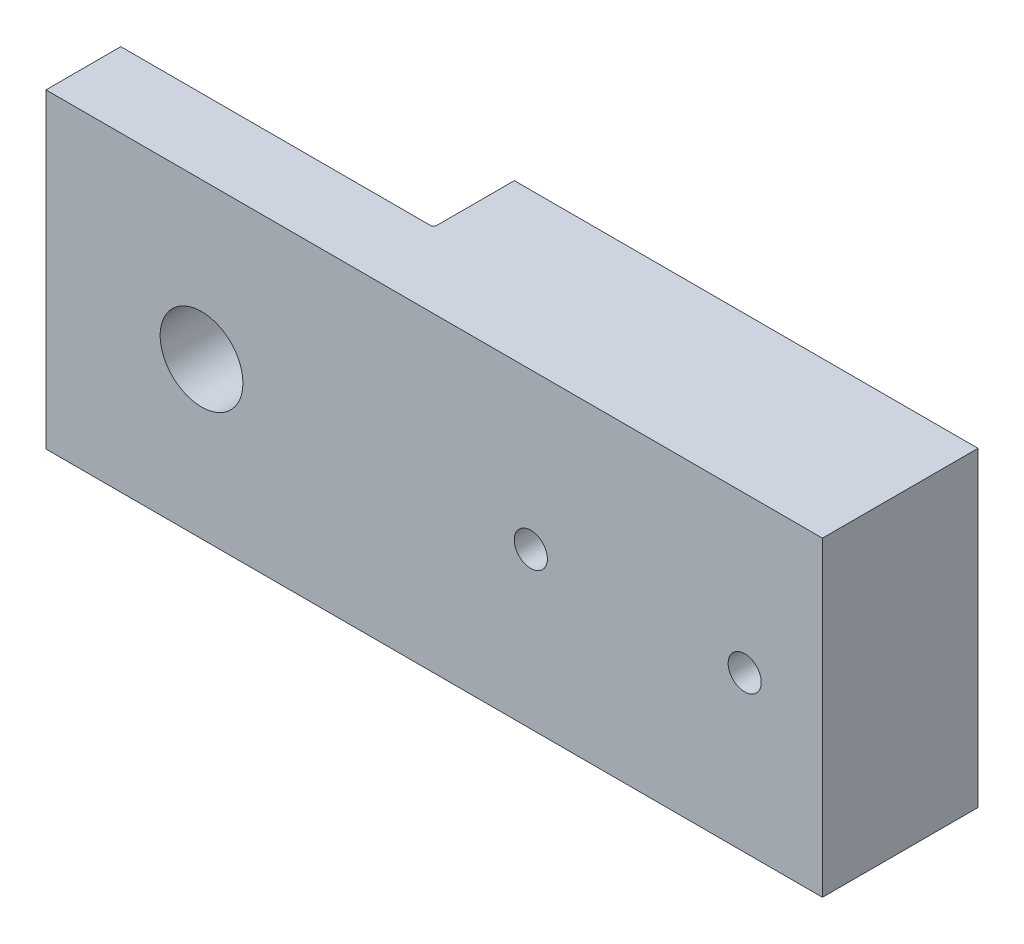
from build123d import *

# Parameters (mm, degrees)
SKETCH1_W                 = 63.398443118
SKETCH1_H                 = 25.4
BOSS_EXTRUDE1_DEPTH       = 6.35
SKETCH2_W                 = 38.1
SKETCH2_H                 = 25.4
BOSS_EXTRUDE2_DEPTH       = 6.35
CUT_EXTRUDE3_DEPTH        = 60.875617776
TAP_DRILL_FOR_6_32_TAP1_D = 2.7051
F_1_4_CLEARANCE_HOLE1_D   = 6.7564


with BuildPart() as part:
    # Sketch1 → Boss-Extrude1 (new body)
    with BuildSketch(Plane.XY):
        with Locations((22.148778441, 406.4)):
            Rectangle(SKETCH1_W, SKETCH1_H)
    extrude(amount=BOSS_EXTRUDE1_DEPTH)

    # Sketch2 → Boss-Extrude2 (add)
    with BuildSketch(Plane(origin=(0, 0, 0), x_dir=(-1, 0, 0), z_dir=(0, 0, -1))):
        with Locations((-34.798, 406.4)):
            Rectangle(SKETCH2_W, SKETCH2_H)
    extrude(amount=BOSS_EXTRUDE2_DEPTH)

    # Sketch7 → Cut-Extrude3 (cut, through all)
    with BuildSketch(Plane(origin=(0, 419.1, 0), x_dir=(1, 0, 0), z_dir=(0, 1, 0))):
        with BuildLine():
            Line((-9.550443118, -0.242852773), (15.748, -0.242852773))
            ThreePointArc((15.748, -0.242852773), (15.919722843, -0.171722843), (15.990852773, 0))
            Line((15.990852773, 0), (15.990852773, 6.35))
            Line((15.990852773, 6.35), (15.748, 6.35))
            Line((15.748, 6.35), (15.748, 0))
            Line((15.748, 0), (-9.550443118, 0))
            Line((-9.550443118, 0), (-9.550443118, -0.242852773))
        make_face()
    extrude(amount=-CUT_EXTRUDE3_DEPTH, mode=Mode.SUBTRACT)

    # Tap Drill for #6-32 Tap1 (through all)
    with Locations(Plane.XY.offset(6.35)):
        with Locations((47.498, 406.4), (30.0355, 406.4)):
            Hole(TAP_DRILL_FOR_6_32_TAP1_D / 2)

    # 1/4 Clearance Hole1 (through all)
    with Locations(Plane.XY.offset(6.35)):
        with Locations((3.149556882, 406.4)):
            Hole(F_1_4_CLEARANCE_HOLE1_D / 2)


solid = part.part
